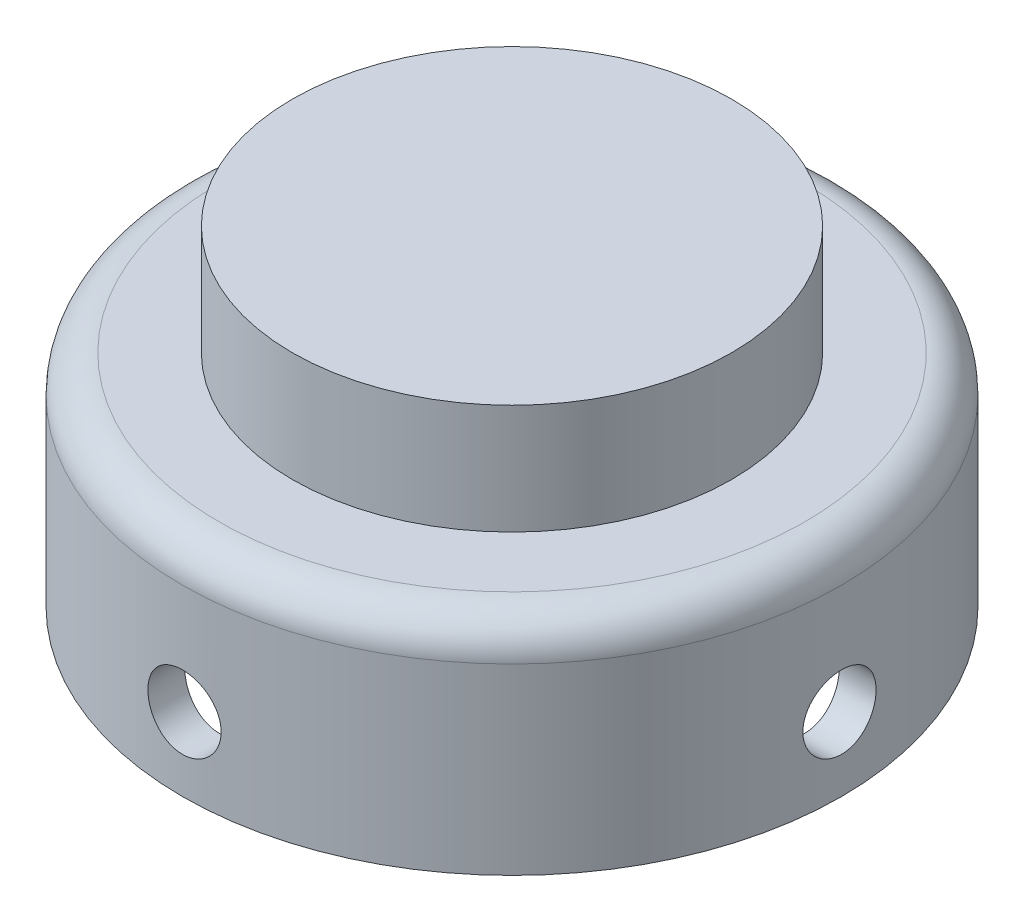
from build123d import *

# Parameters (mm, degrees)
SKETCH1_R               = 76.2
BOSS_EXTRUDE1_DEPTH     = 38.1
SKETCH2_R               = 114.3
BOSS_EXTRUDE2_DEPTH     = 76.2
FILLET2_R               = 12.7
SKETCH3_R               = 101.6
CUT_EXTRUDE1_DEPTH      = 50.8
CUT_EXTRUDE2_DEPTH      = 179.704840513
CUT_EXTRUDE2_DEPTH_BACK = 179.704840513
SKETCH4_R               = 12.7
CUT_EXTRUDE3_DEPTH      = 179.704840621
CUT_EXTRUDE3_DEPTH_BACK = 179.704840621
SKETCH5_R               = 12.7


with BuildPart() as part:
    # Sketch1 → Boss-Extrude1 (new body)
    with BuildSketch(Plane(origin=(0, 0, 0), x_dir=(1, 0, 0), z_dir=(0, 1, 0))):
        with Locations(Location((0, 0, 0), (0, 0, 90))):
            Circle(SKETCH1_R)
    extrude(amount=BOSS_EXTRUDE1_DEPTH)

    # Sketch2 → Boss-Extrude2 (add)
    with BuildSketch(Plane.XZ):
        with Locations(Location((0, 0, 0), (0, 0, 90))):
            Circle(SKETCH2_R)
    extrude(amount=BOSS_EXTRUDE2_DEPTH)

    # Fillet2
    fillet2_edges = [part.edges().sort_by_distance(p)[0] for p in [
        (0, 0, -114.3),
    ]]
    fillet(fillet2_edges, radius=FILLET2_R)

    # Sketch3 → Cut-Extrude1 (cut)
    with BuildSketch(Plane.XZ.offset(76.2)):
        with Locations(Location((0, 0, 0), (0, 0, 270))):
            Circle(SKETCH3_R)
    extrude(amount=-CUT_EXTRUDE1_DEPTH, mode=Mode.SUBTRACT)

    # Sketch4 → Cut-Extrude2 (cut, two sides: drawn at the far end of the back side and taken through both)
    with BuildSketch(Plane(origin=(0, 0, 0), x_dir=(0, 0, -1), z_dir=(1, 0, 0)).offset(-CUT_EXTRUDE2_DEPTH_BACK)):
        with Locations((0, -50.8)):
            Circle(SKETCH4_R)
    extrude(amount=CUT_EXTRUDE2_DEPTH + CUT_EXTRUDE2_DEPTH_BACK, mode=Mode.SUBTRACT)

    # Sketch5 → Cut-Extrude3 (cut, two sides: drawn at the far end of the back side and taken through both)
    with BuildSketch(Plane.XY.offset(-CUT_EXTRUDE3_DEPTH_BACK)):
        with Locations((0, -50.8)):
            Circle(SKETCH5_R)
    extrude(amount=CUT_EXTRUDE3_DEPTH + CUT_EXTRUDE3_DEPTH_BACK, mode=Mode.SUBTRACT)


solid = part.part
